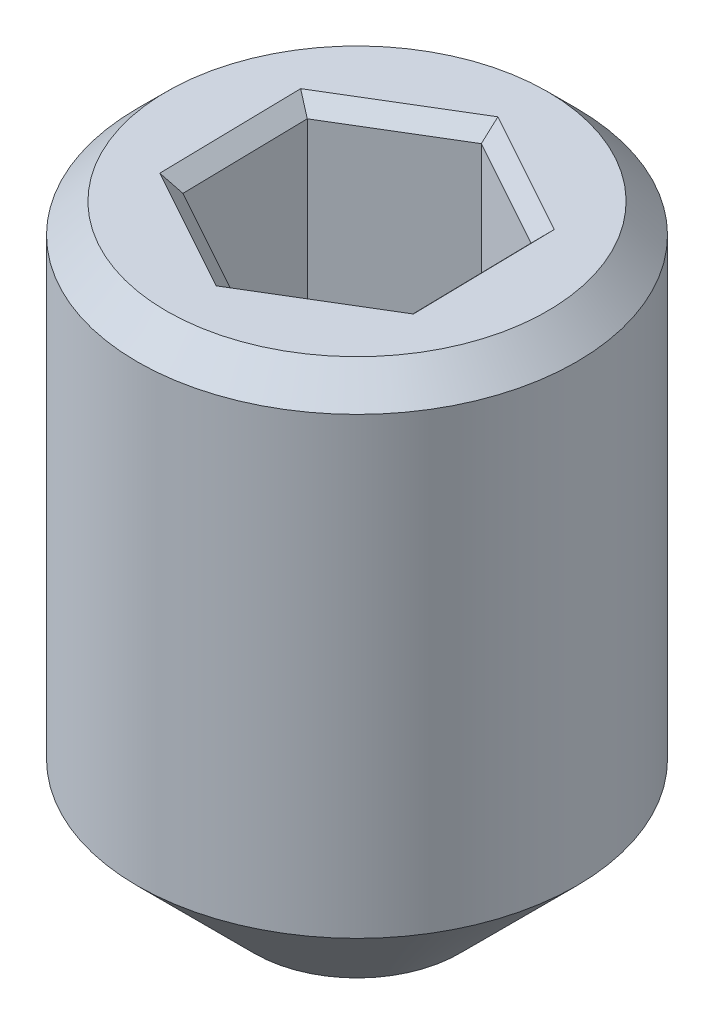
from build123d import *

# Parameters (mm, degrees)
SKETCH1_R           = 1.5
BOSS_EXTRUDE1_DEPTH = 4.1
CUT_EXTRUDE2_DEPTH  = 2
CHAMFER1_SIZE       = 0.2
CHAMFER2_SIZE       = 0.1
FILLET3_R           = 0.6
CHAMFER3_SIZE       = 0.8


with BuildPart() as part:
    # Sketch1 → Boss-Extrude1 (new body)
    with BuildSketch(Plane(origin=(0, 0, 0), x_dir=(1, 0, 0), z_dir=(0, 1, 0))):
        with Locations(Location((0, 0, 0), (0, 0, 270))):
            Circle(SKETCH1_R)
    extrude(amount=BOSS_EXTRUDE1_DEPTH)

    # Sketch2 → Cut-Extrude2 (cut)
    with BuildSketch(Plane(origin=(0, 4.1, 0), x_dir=(1, 0, 0), z_dir=(0, 1, 0))):
        Polygon((0.758195887, -0.418496113), (0.741526209, 0.447368843), (-0.016669678, 0.865864956), (-0.758195887, 0.418496113), (-0.741526209, -0.447368843), (0.016669678, -0.865864956), align=None)
    extrude(amount=-CUT_EXTRUDE2_DEPTH, mode=Mode.SUBTRACT)

    # Chamfer1
    chamfer1_edges = [part.edges().sort_by_distance(p)[0] for p in [
        (0, 4.1, -1.5),
    ]]
    chamfer(chamfer1_edges, length=CHAMFER1_SIZE)

    # Chamfer2
    chamfer2_edges = [part.edges().sort_by_distance(p)[0] for p in [
        (0.387432783, 4.1, 0.642180535),
        (0.749861048, 4.1, -0.014436365),
        (0.362428265, 4.1, -0.656616899),
        (-0.387432783, 4.1, -0.642180535),
        (-0.749861048, 4.1, 0.014436365),
        (-0.362428265, 4.1, 0.656616899),
    ]]
    chamfer(chamfer2_edges, length=CHAMFER2_SIZE)

    # Fillet3
    fillet3_edges = [part.edges().sort_by_distance(p)[0] for p in [
        (0.749861048, 2.1, -0.014436365),
        (0.387432783, 2.1, 0.642180535),
        (-0.362428265, 2.1, 0.656616899),
        (-0.749861048, 2.1, 0.014436365),
        (-0.387432783, 2.1, -0.642180535),
        (0.362428265, 2.1, -0.656616899),
    ]]
    fillet(fillet3_edges, radius=FILLET3_R)

    # Chamfer3
    chamfer3_edges = [part.edges().sort_by_distance(p)[0] for p in [
        (0, 0, -1.5),
    ]]
    chamfer(chamfer3_edges, length=CHAMFER3_SIZE)


solid = part.part
